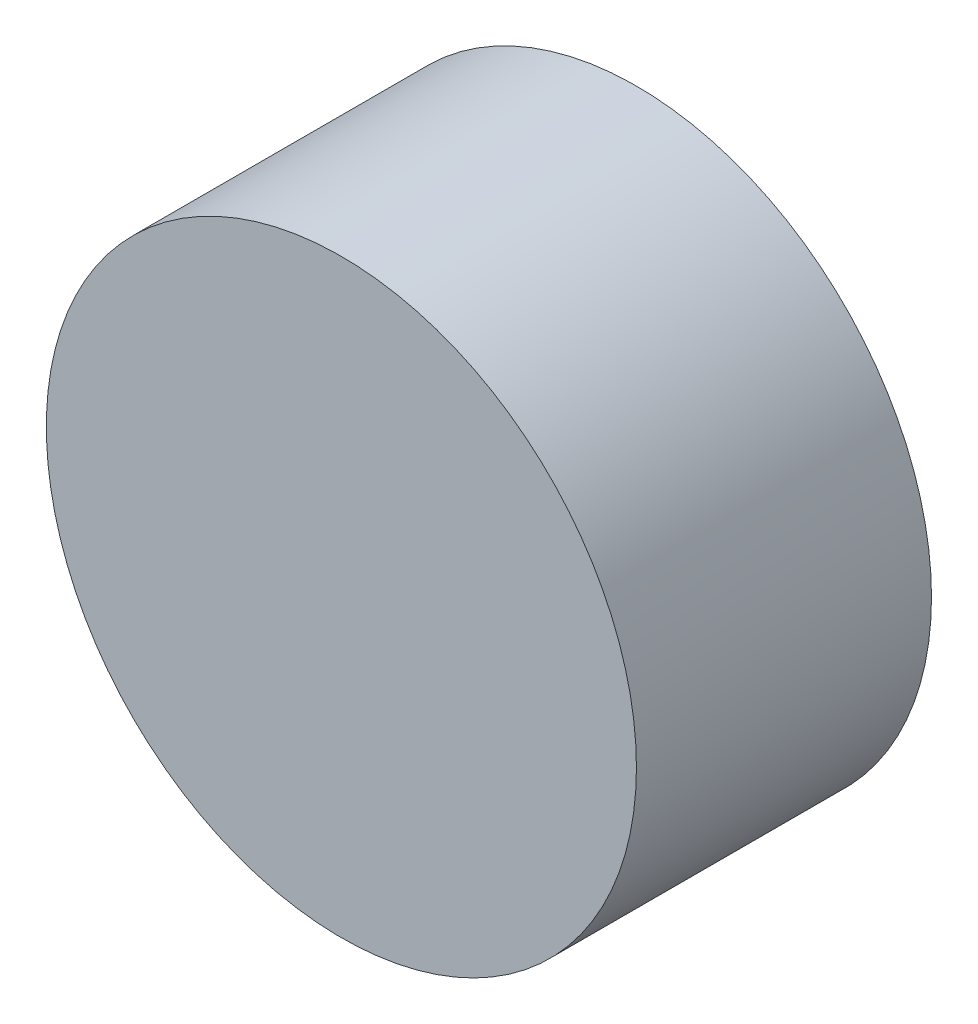
from build123d import *

# Parameters (mm, degrees)
SKETCH1_R           = 2.5
BOSS_EXTRUDE1_DEPTH = 2.5


with BuildPart() as part:
    # Sketch1 → Boss-Extrude1 (new body)
    with BuildSketch(Plane.XY):
        Circle(SKETCH1_R)
    extrude(amount=BOSS_EXTRUDE1_DEPTH)


solid = part.part
